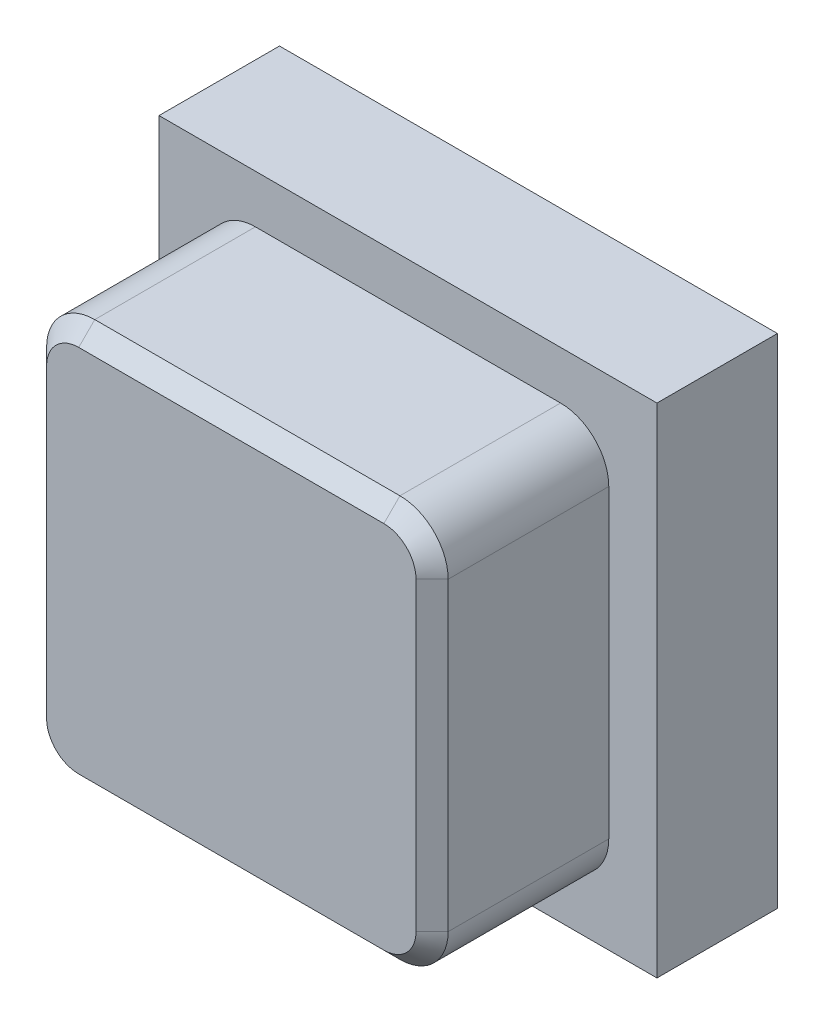
from build123d import *

# Parameters (mm, degrees)
SKETCH_1_W          = 10
SKETCH_1_H          = 10
EXTRUDE_1_DEPTH     = 4.4
SKETCH_2_W          = 12.4
SKETCH_2_H          = 12.4
EXTRUDE_2_DEPTH     = 3
SKETCH_3_R          = 1.8
CUT_EXTRUDE_1_DEPTH = 3
FILLET_1_R          = 1.2
CHAMFER_1_SIZE      = 0.4
CHAMFER_2_SIZE      = 0.4


with BuildPart() as part:
    # Эскиз1 → Бобышка-Вытянуть1 (new body)
    with BuildSketch(Plane.XY):
        with Locations((5, -5)):
            Rectangle(SKETCH_1_W, SKETCH_1_H)
    extrude(amount=EXTRUDE_1_DEPTH)

    # Эскиз2 → Бобышка-Вытянуть2 (add)
    with BuildSketch(Plane(origin=(0, 0, 0), x_dir=(-1, 0, 0), z_dir=(0, 0, -1))):
        with Locations((-5, -5)):
            Rectangle(SKETCH_2_W, SKETCH_2_H)
    extrude(amount=EXTRUDE_2_DEPTH)

    # Эскиз3 → Вырез-Вытянуть1 (cut)
    with BuildSketch(Plane(origin=(0, 0, -3), x_dir=(-1, 0, 0), z_dir=(0, 0, -1))):
        with Locations((-5, -5)):
            Circle(SKETCH_3_R)
    extrude(amount=-CUT_EXTRUDE_1_DEPTH, mode=Mode.SUBTRACT)

    # Скругление1
    fillet_1_edges = [part.edges().sort_by_distance(p)[0] for p in [
        (0, 0, 2.2),
        (10, 0, 2.2),
        (10, -10, 2.2),
        (0, -10, 2.2),
    ]]
    fillet(fillet_1_edges, radius=FILLET_1_R)

    # Фаска1
    chamfer_1_edges = [part.edges().sort_by_distance(p)[0] for p in [
        (5, 0, 4.4),
        (10, -5, 4.4),
        (0, -5, 4.4),
        (5, -10, 4.4),
        (9.648528137, -9.648528137, 4.4),
        (0.351471863, -9.648528137, 4.4),
        (0.351471863, -0.351471863, 4.4),
        (9.648528137, -0.351471863, 4.4),
    ]]
    chamfer(chamfer_1_edges, length=CHAMFER_1_SIZE)

    # Фаска2
    chamfer_2_edges = [part.edges().sort_by_distance(p)[0] for p in [
        (6.8, -5, -3),
    ]]
    chamfer(chamfer_2_edges, length=CHAMFER_2_SIZE)


solid = part.part
